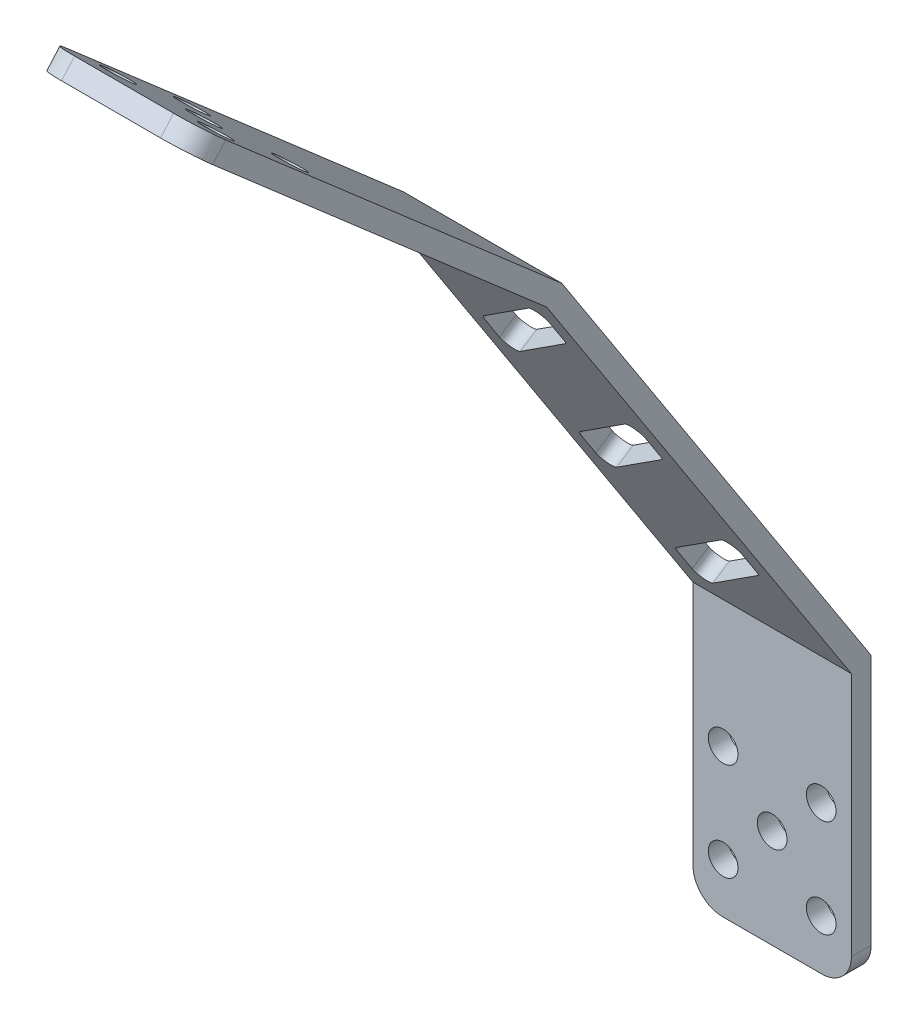
from build123d import *

# Parameters (mm, degrees)
SKETCH_1_W          = 16
SKETCH_1_H          = 48
EXTRUDE_1_DEPTH     = 3
SKETCH_2_R          = 1.5
CUT_EXTRUDE_1_DEPTH = 26.475478406
SKETCH_3_W          = 16
SKETCH_3_H          = 88
EXTRUDE_2_DEPTH     = 3
SKETCH_4_W          = 16
SKETCH_4_H          = 3
EXTRUDE_3_DEPTH     = 2
SKETCH_5_R          = 1.5
CUT_EXTRUDE_2_DEPTH = 108.805767963
FILLET_3_R          = 3
EXTRUDE_4_DEPTH     = 16
CUT_EXTRUDE_3_DEPTH = 111.135894355
CUT_EXTRUDE_4_DEPTH = 111.135894355
CUT_EXTRUDE_5_DEPTH = 110.131666201
FILLET_4_R          = 1


with BuildPart() as part:
    # 草图1 → 凸台-拉伸1 (new body)
    with BuildSketch(Plane.XY):
        Rectangle(SKETCH_1_W, SKETCH_1_H)
    extrude(amount=EXTRUDE_1_DEPTH)

    # 草图2 → 切除-拉伸1 (cut, through all)
    with BuildSketch(Plane.XY.offset(3)):
        with Locations((-4.949747468, -9.050252532)):
            Circle(SKETCH_2_R)
        with Locations((0, -14)):
            Circle(SKETCH_2_R)
        with Locations((4.949747468, -9.050252532)):
            Circle(SKETCH_2_R)
        with Locations((4.949747468, -18.949747468)):
            Circle(SKETCH_2_R)
        with Locations((-4.949747468, -18.949747468)):
            Circle(SKETCH_2_R)
    extrude(amount=-CUT_EXTRUDE_1_DEPTH, mode=Mode.SUBTRACT)



with BuildPart() as body_2:
    # 草图3 → 凸台-拉伸2 (new body)
    with BuildSketch(Plane(origin=(0, 12.184675108, -10.591976476), x_dir=(-1, 0, 0), z_dir=(0, 0.7547095802227686, -0.6560590289905112))):
        with Locations((0, 62.009545436)):
            Rectangle(SKETCH_3_W, SKETCH_3_H)
    extrude(amount=EXTRUDE_2_DEPTH)


with BuildPart() as part_1:
    add(part.part)

    add(body_2.part)  # 凸台-拉伸3 merges body 2
    # 草图4 → 凸台-拉伸3 (add)
    with BuildSketch(Plane(origin=(0, 11.815324892, 13.591976476), x_dir=(-1, 0, 0), z_dir=(0, -0.6560590289905113, -0.7547095802227686))):
        with Locations((0, 17.644852838)):
            Rectangle(SKETCH_4_W, SKETCH_4_H)
    extrude(amount=EXTRUDE_3_DEPTH)

    # 草图5 → 切除-拉伸2 (cut, through all)
    with BuildSketch(Plane(origin=(0, 12.184675108, -10.591976476), x_dir=(1, 0, 0), z_dir=(0, -0.7547095802227686, 0.6560590289905113))):
        with Locations(Location((0, 95.34, 0), (0, 0, 270))):
            Circle(SKETCH_5_R)
        with Locations(Location((-4.949747468, 100.289747468, 0), (0, 0, 270))):
            Circle(SKETCH_5_R)
        with Locations(Location((4.949747468, 100.289747468, 0), (0, 0, 270))):
            Circle(SKETCH_5_R)
        with Locations(Location((4.949747468, 90.390252532, 0), (0, 0, 270))):
            Circle(SKETCH_5_R)
        with Locations(Location((-4.949747468, 90.390252532, 0), (0, 0, 270))):
            Circle(SKETCH_5_R)
    extrude(amount=-CUT_EXTRUDE_2_DEPTH, mode=Mode.SUBTRACT)

    # 圆角3
    fillet_3_edges = [part_1.edges().sort_by_distance(p)[0] for p in [
        (8, 82.865258921, 68.430354516),
        (-8, 82.865258921, 68.430354516),
        (8, -24, 1.5),
        (-8, -24, 1.5),
    ]]
    fillet(fillet_3_edges, radius=FILLET_3_R)

    # 草图6 → 凸台-拉伸4 (add)
    with BuildSketch(Plane.ZY.offset(8)):
        Polygon((33.531489951, 50.5406193), (3, 3.472509188), (0, 4.360298556), (31.244508057, 52.52761525), align=None)
    extrude(amount=-EXTRUDE_4_DEPTH)

    # 草图9 → 切除-拉伸3 (cut, through all)
    with BuildSketch(Plane(origin=(8, 0, 0), x_dir=(0, 0, -1), z_dir=(1, 0, 0))):
        Polygon((0, 4.360298556), (-31.244508057, 52.52761525), (6.052752185, 30.680291416), align=None)
    extrude(amount=-CUT_EXTRUDE_3_DEPTH, mode=Mode.SUBTRACT)

    # 草图11 → 切除-拉伸4 (cut, through all)
    with BuildSketch(Plane.ZY.offset(8)):
        Polygon((33.531489951, 50.5406193), (3, 3.472509188), (3, -21), (2, -21), (2, -26.591575896), (76.346344159, 89.084017238), (66.49425529, 80.519727044), (67.150314319, 79.765017464), align=None)
        Polygon((66.49425529, 80.519727044), (32.769162653, 51.202951283), (33.531489951, 50.5406193), (67.150314319, 79.765017464), align=None)
        Polygon((32.769162653, 51.202951283), (2, 3.768438978), (3, 3.472509188), (33.531489951, 50.5406193), align=None)
        Polygon((3, 3.472509188), (2, 3.768438978), (2, -21), (3, -21), align=None)
    extrude(amount=-CUT_EXTRUDE_4_DEPTH, mode=Mode.SUBTRACT)

    # 草图12 → 切除-拉伸5 (cut, through all)
    with BuildSketch(Plane(origin=(0, 1.291325132, -1.990739187), x_dir=(-1, 0, 0), z_dir=(0, 0.5442014418825505, -0.8389545819965185))):
        Polygon((-6, 53.414735581), (6, 41.414735581), (6, 47.07158983), (-6, 59.07158983), align=None)
        Polygon((-6, 17.658092453), (6, 5.658092453), (6, 11.314946702), (-6, 23.314946702), align=None)
        Polygon((-6, 35.536414017), (6, 23.536414017), (6, 29.193268266), (-6, 41.193268266), align=None)
    extrude(amount=-CUT_EXTRUDE_5_DEPTH, mode=Mode.SUBTRACT)

    # 圆角4
    fillet_4_edges = [part_1.edges().sort_by_distance(p)[0] for p in [
        (6, 50.305504644, 30.995059755),
        (-6, 40.23804966, 24.464642452),
        (-6, 35.492205868, 21.386174213),
        (6, 45.559660852, 27.916591516),
        (6, 35.306404849, 21.265651381),
        (-6, 20.493106073, 11.656765839),
        (-6, 25.238949865, 14.735234079),
        (6, 30.560561057, 18.187183142),
        (6, 20.307305055, 11.536243007),
        (-6, 10.239850071, 5.005825705),
        (-6, 5.494006278, 1.927357466),
        (6, 15.561461262, 8.457774768),
    ]]
    fillet(fillet_4_edges, radius=FILLET_4_R)


solid = part_1.part
